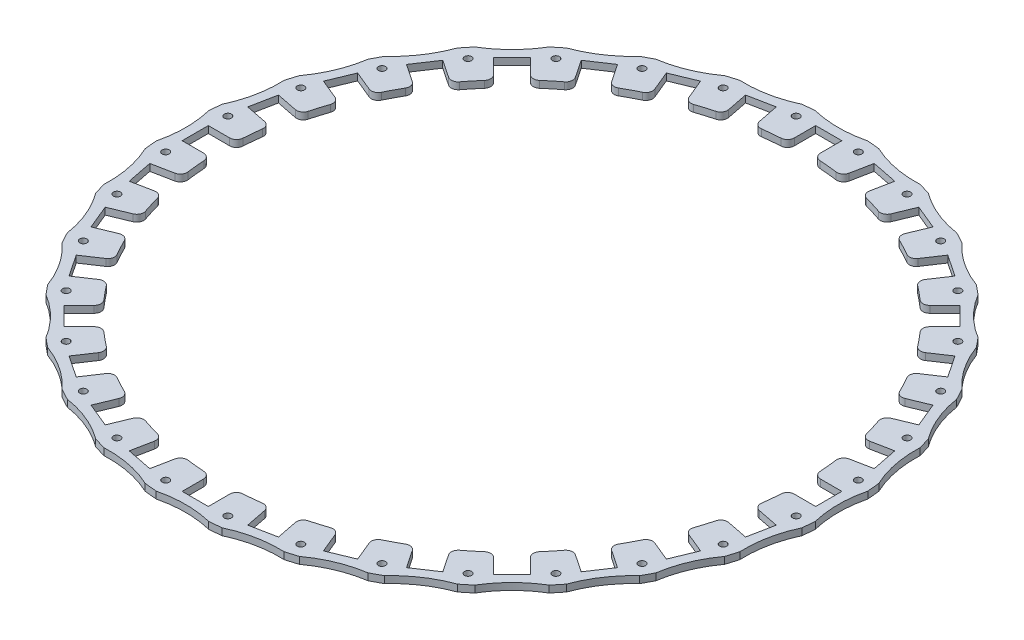
from build123d import *

# Parameters (mm, degrees)
BOSS_EXTRUDE1_DEPTH = 3.175
SKETCH4_R           = 1.6383
CUT_EXTRUDE1_DEPTH  = 215.868868303
CIRPATTERN1_COUNT   = 32


with BuildPart() as part:
    # Sketch1 → Boss-Extrude1 (new body)
    with BuildSketch(Plane(origin=(0, 0, 0), x_dir=(1, 0, 0), z_dir=(0, 1, 0))):
        with BuildLine():
            ThreePointArc((151.918645894, -12.1031), (150.455801978, 0), (151.918645894, 12.1031))
            ThreePointArc((151.918645894, 12.1031), (151.666152345, 14.937812186), (151.360769388, 17.767315221))
            ThreePointArc((151.360769388, 17.767315221), (147.564835931, 29.352470857), (146.638374036, 41.508399875))
            ThreePointArc((146.638374036, 41.508399875), (145.837707166, 44.239384814), (144.986183399, 46.954942481))
            ThreePointArc((144.986183399, 46.954942481), (139.003035995, 57.57694272), (135.722871698, 69.318555221))
            ThreePointArc((135.722871698, 69.318555221), (134.404800687, 71.840862692), (133.039859691, 74.338117635))
            ThreePointArc((133.039859691, 74.338117635), (125.099427339, 83.588764964), (119.591615516, 94.464837364))
            ThreePointArc((119.591615516, 94.464837364), (117.806793092, 96.681536507), (115.980888784, 98.864520617))
            ThreePointArc((115.980888784, 98.864520617), (106.388317847, 106.388317847), (98.864520617, 115.980888784))
            ThreePointArc((98.864520617, 115.980888784), (96.681536507, 117.806793092), (94.464837364, 119.591615516))
            ThreePointArc((94.464837364, 119.591615516), (83.588764964, 125.099427339), (74.338117635, 133.039859691))
            ThreePointArc((74.338117635, 133.039859691), (71.840862692, 134.404800687), (69.318555221, 135.722871698))
            ThreePointArc((69.318555221, 135.722871698), (57.57694272, 139.003035995), (46.954942481, 144.986183399))
            ThreePointArc((46.954942481, 144.986183399), (44.239384814, 145.837707166), (41.508399875, 146.638374036))
            ThreePointArc((41.508399875, 146.638374036), (29.352470857, 147.564835931), (17.767315221, 151.360769388))
            ThreePointArc((17.767315221, 151.360769388), (14.937812186, 151.666152345), (12.1031, 151.918645894))
            ThreePointArc((12.1031, 151.918645894), (0, 150.455801978), (-12.1031, 151.918645894))
            ThreePointArc((-12.1031, 151.918645894), (-14.937812186, 151.666152345), (-17.767315221, 151.360769388))
            ThreePointArc((-17.767315221, 151.360769388), (-29.352470857, 147.564835931), (-41.508399875, 146.638374036))
            ThreePointArc((-41.508399875, 146.638374036), (-44.239384814, 145.837707166), (-46.954942481, 144.986183399))
            ThreePointArc((-46.954942481, 144.986183399), (-57.57694272, 139.003035995), (-69.318555221, 135.722871698))
            ThreePointArc((-69.318555221, 135.722871698), (-71.840862692, 134.404800687), (-74.338117635, 133.039859691))
            ThreePointArc((-74.338117635, 133.039859691), (-83.588764964, 125.099427339), (-94.464837364, 119.591615516))
            ThreePointArc((-94.464837364, 119.591615516), (-96.681536507, 117.806793092), (-98.864520617, 115.980888784))
            ThreePointArc((-98.864520617, 115.980888784), (-106.388317847, 106.388317847), (-115.980888784, 98.864520617))
            ThreePointArc((-115.980888784, 98.864520617), (-117.806793092, 96.681536507), (-119.591615516, 94.464837364))
            ThreePointArc((-119.591615516, 94.464837364), (-125.099427339, 83.588764964), (-133.039859691, 74.338117635))
            ThreePointArc((-133.039859691, 74.338117635), (-134.404800687, 71.840862692), (-135.722871698, 69.318555221))
            ThreePointArc((-135.722871698, 69.318555221), (-139.003035995, 57.57694272), (-144.986183399, 46.954942481))
            ThreePointArc((-144.986183399, 46.954942481), (-145.837707166, 44.239384814), (-146.638374036, 41.508399875))
            ThreePointArc((-146.638374036, 41.508399875), (-147.564835931, 29.352470857), (-151.360769388, 17.767315221))
            ThreePointArc((-151.360769388, 17.767315221), (-151.666152345, 14.937812186), (-151.918645894, 12.1031))
            ThreePointArc((-151.918645894, 12.1031), (-150.455801978, 0), (-151.918645894, -12.1031))
            ThreePointArc((-151.918645894, -12.1031), (-151.666152345, -14.937812186), (-151.360769388, -17.767315221))
            ThreePointArc((-151.360769388, -17.767315221), (-147.564835931, -29.352470857), (-146.638374036, -41.508399875))
            ThreePointArc((-146.638374036, -41.508399875), (-145.837707166, -44.239384814), (-144.986183399, -46.954942481))
            ThreePointArc((-144.986183399, -46.954942481), (-139.003035995, -57.57694272), (-135.722871698, -69.318555221))
            ThreePointArc((-135.722871698, -69.318555221), (-134.404800687, -71.840862692), (-133.039859691, -74.338117635))
            ThreePointArc((-133.039859691, -74.338117635), (-125.099427339, -83.588764964), (-119.591615516, -94.464837364))
            ThreePointArc((-119.591615516, -94.464837364), (-117.806793092, -96.681536507), (-115.980888784, -98.864520617))
            ThreePointArc((-115.980888784, -98.864520617), (-106.388317847, -106.388317847), (-98.864520617, -115.980888784))
            ThreePointArc((-98.864520617, -115.980888784), (-96.681536507, -117.806793092), (-94.464837364, -119.591615516))
            ThreePointArc((-94.464837364, -119.591615516), (-83.588764964, -125.099427339), (-74.338117635, -133.039859691))
            ThreePointArc((-74.338117635, -133.039859691), (-71.840862692, -134.404800687), (-69.318555221, -135.722871698))
            ThreePointArc((-69.318555221, -135.722871698), (-57.57694272, -139.003035995), (-46.954942481, -144.986183399))
            ThreePointArc((-46.954942481, -144.986183399), (-44.239384814, -145.837707166), (-41.508399875, -146.638374036))
            ThreePointArc((-41.508399875, -146.638374036), (-29.352470857, -147.564835931), (-17.767315221, -151.360769388))
            ThreePointArc((-17.767315221, -151.360769388), (-14.937812186, -151.666152345), (-12.1031, -151.918645894))
            ThreePointArc((-12.1031, -151.918645894), (0, -150.455801978), (12.1031, -151.918645894))
            ThreePointArc((12.1031, -151.918645894), (14.937812186, -151.666152345), (17.767315221, -151.360769388))
            ThreePointArc((17.767315221, -151.360769388), (29.352470857, -147.564835931), (41.508399875, -146.638374036))
            ThreePointArc((41.508399875, -146.638374036), (44.239384814, -145.837707166), (46.954942481, -144.986183399))
            ThreePointArc((46.954942481, -144.986183399), (57.57694272, -139.003035995), (69.318555221, -135.722871698))
            ThreePointArc((69.318555221, -135.722871698), (71.840862692, -134.404800687), (74.338117635, -133.039859691))
            ThreePointArc((74.338117635, -133.039859691), (83.588764964, -125.099427339), (94.464837364, -119.591615516))
            ThreePointArc((94.464837364, -119.591615516), (96.681536507, -117.806793092), (98.864520617, -115.980888784))
            ThreePointArc((98.864520617, -115.980888784), (106.388317847, -106.388317847), (115.980888784, -98.864520617))
            ThreePointArc((115.980888784, -98.864520617), (117.806793092, -96.681536507), (119.591615516, -94.464837364))
            ThreePointArc((119.591615516, -94.464837364), (125.099427339, -83.588764964), (133.039859691, -74.338117635))
            ThreePointArc((133.039859691, -74.338117635), (134.404800687, -71.840862692), (135.722871698, -69.318555221))
            ThreePointArc((135.722871698, -69.318555221), (139.003035995, -57.57694272), (144.986183399, -46.954942481))
            ThreePointArc((144.986183399, -46.954942481), (145.837707166, -44.239384814), (146.638374036, -41.508399875))
            ThreePointArc((146.638374036, -41.508399875), (147.564835931, -29.352470857), (151.360769388, -17.767315221))
            ThreePointArc((151.360769388, -17.767315221), (151.666152345, -14.937812186), (151.918645894, -12.1031))
        make_face()
        with BuildLine():
            ThreePointArc((133.046389498, 8.993372093), (134.046123673, 6.887965445), (136.214160676, 6.0325))
            Line((136.214160676, 6.0325), (146.05, 6.0325))
            Line((146.05, 6.0325), (146.05, -6.0325))
            Line((146.05, -6.0325), (136.214160676, -6.0325))
            ThreePointArc((136.214160676, -6.0325), (134.046123673, -6.887965445), (133.046389498, -8.993372093))
            ThreePointArc((133.046389498, -8.993372093), (132.707883302, -13.070585663), (132.244460288, -17.135496))
            ThreePointArc((132.244460288, -17.135496), (132.81424039, -19.395486312), (134.773726141, -20.657477265))
            Line((134.773726141, -20.657477265), (144.42057257, -22.576354326))
            Line((144.42057257, -22.576354326), (142.066807835, -34.409528734))
            Line((142.066807835, -34.409528734), (132.419961406, -32.490651674))
            ThreePointArc((132.419961406, -32.490651674), (130.126689597, -32.906716553), (128.735420573, -34.77662994))
            ThreePointArc((128.735420573, -34.77662994), (127.60799377, -38.709461712), (126.360450633, -42.605856592))
            ThreePointArc((126.360450633, -42.605856592), (126.478380332, -44.933580407), (128.154012893, -46.553599264))
            Line((128.154012893, -46.553599264), (137.241143529, -50.317612017))
            Line((137.241143529, -50.317612017), (132.624067918, -61.464218577))
            Line((132.624067918, -61.464218577), (123.536937281, -57.700205824))
            ThreePointArc((123.536937281, -57.700205824), (121.206559816, -57.660880998), (119.47722163, -59.223441402))
            ThreePointArc((119.47722163, -59.223441402), (117.604200601, -62.860754856), (115.620479723, -66.438898008))
            ThreePointArc((115.620479723, -66.438898008), (115.282027048, -68.744902206), (116.609412798, -70.660692551))
            Line((116.609412798, -70.660692551), (124.787614307, -76.125192096))
            Line((124.787614307, -76.125192096), (118.084659446, -86.156872969))
            Line((118.084659446, -86.156872969), (109.906457937, -80.692373424))
            ThreePointArc((109.906457937, -80.692373424), (107.628529914, -80.199170122), (105.627580065, -81.394329223))
            ThreePointArc((105.627580065, -81.394329223), (103.080943956, -84.596344443), (100.437278619, -87.718729834))
            ThreePointArc((100.437278619, -87.718729834), (99.655450116, -89.914395966), (100.583578365, -92.05233505))
            Line((100.583578365, -92.05233505), (107.53856705, -99.007323735))
            Line((107.53856705, -99.007323735), (99.007323735, -107.53856705))
            Line((99.007323735, -107.53856705), (92.05233505, -100.583578365))
            ThreePointArc((92.05233505, -100.583578365), (89.914395966, -99.655450116), (87.718729834, -100.437278619))
            ThreePointArc((87.718729834, -100.437278619), (84.596344443, -103.080943956), (81.394329223, -105.627580065))
            ThreePointArc((81.394329223, -105.627580065), (80.199170122, -107.628529914), (80.692373424, -109.906457937))
            Line((80.692373424, -109.906457937), (86.156872969, -118.084659446))
            Line((86.156872969, -118.084659446), (76.125192096, -124.787614307))
            Line((76.125192096, -124.787614307), (70.660692551, -116.609412798))
            ThreePointArc((70.660692551, -116.609412798), (68.744902206, -115.282027048), (66.438898008, -115.620479723))
            ThreePointArc((66.438898008, -115.620479723), (62.860754856, -117.604200601), (59.223441402, -119.47722163))
            ThreePointArc((59.223441402, -119.47722163), (57.660880998, -121.206559816), (57.700205824, -123.536937281))
            Line((57.700205824, -123.536937281), (61.464218577, -132.624067918))
            Line((61.464218577, -132.624067918), (50.317612017, -137.241143529))
            Line((50.317612017, -137.241143529), (46.553599264, -128.154012893))
            ThreePointArc((46.553599264, -128.154012893), (44.933580407, -126.478380332), (42.605856592, -126.360450633))
            ThreePointArc((42.605856592, -126.360450633), (38.709461712, -127.60799377), (34.77662994, -128.735420573))
            ThreePointArc((34.77662994, -128.735420573), (32.906716553, -130.126689597), (32.490651674, -132.419961406))
            Line((32.490651674, -132.419961406), (34.409528734, -142.066807835))
            Line((34.409528734, -142.066807835), (22.576354326, -144.42057257))
            Line((22.576354326, -144.42057257), (20.657477265, -134.773726141))
            ThreePointArc((20.657477265, -134.773726141), (19.395486312, -132.81424039), (17.135496, -132.244460288))
            ThreePointArc((17.135496, -132.244460288), (13.070585663, -132.707883302), (8.993372093, -133.046389498))
            ThreePointArc((8.993372093, -133.046389498), (6.887965445, -134.046123673), (6.0325, -136.214160676))
            Line((6.0325, -136.214160676), (6.0325, -146.05))
            Line((6.0325, -146.05), (-6.0325, -146.05))
            Line((-6.0325, -146.05), (-6.0325, -136.214160676))
            ThreePointArc((-6.0325, -136.214160676), (-6.887965445, -134.046123673), (-8.993372093, -133.046389498))
            ThreePointArc((-8.993372093, -133.046389498), (-13.070585663, -132.707883302), (-17.135496, -132.244460288))
            ThreePointArc((-17.135496, -132.244460288), (-19.395486312, -132.81424039), (-20.657477265, -134.773726141))
            Line((-20.657477265, -134.773726141), (-22.576354326, -144.42057257))
            Line((-22.576354326, -144.42057257), (-34.409528734, -142.066807835))
            Line((-34.409528734, -142.066807835), (-32.490651674, -132.419961406))
            ThreePointArc((-32.490651674, -132.419961406), (-32.906716553, -130.126689597), (-34.77662994, -128.735420573))
            ThreePointArc((-34.77662994, -128.735420573), (-38.709461712, -127.60799377), (-42.605856592, -126.360450633))
            ThreePointArc((-42.605856592, -126.360450633), (-44.933580407, -126.478380332), (-46.553599264, -128.154012893))
            Line((-46.553599264, -128.154012893), (-50.317612017, -137.241143529))
            Line((-50.317612017, -137.241143529), (-61.464218577, -132.624067918))
            Line((-61.464218577, -132.624067918), (-57.700205824, -123.536937281))
            ThreePointArc((-57.700205824, -123.536937281), (-57.660880998, -121.206559816), (-59.223441402, -119.47722163))
            ThreePointArc((-59.223441402, -119.47722163), (-62.860754856, -117.604200601), (-66.438898008, -115.620479723))
            ThreePointArc((-66.438898008, -115.620479723), (-68.744902206, -115.282027048), (-70.660692551, -116.609412798))
            Line((-70.660692551, -116.609412798), (-76.125192096, -124.787614307))
            Line((-76.125192096, -124.787614307), (-86.156872969, -118.084659446))
            Line((-86.156872969, -118.084659446), (-80.692373424, -109.906457937))
            ThreePointArc((-80.692373424, -109.906457937), (-80.199170122, -107.628529914), (-81.394329223, -105.627580065))
            ThreePointArc((-81.394329223, -105.627580065), (-84.596344443, -103.080943956), (-87.718729834, -100.437278619))
            ThreePointArc((-87.718729834, -100.437278619), (-89.914395966, -99.655450116), (-92.05233505, -100.583578365))
            Line((-92.05233505, -100.583578365), (-99.007323735, -107.53856705))
            Line((-99.007323735, -107.53856705), (-107.53856705, -99.007323735))
            Line((-107.53856705, -99.007323735), (-100.583578365, -92.05233505))
            ThreePointArc((-100.583578365, -92.05233505), (-99.655450116, -89.914395966), (-100.437278619, -87.718729834))
            ThreePointArc((-100.437278619, -87.718729834), (-103.080943956, -84.596344443), (-105.627580065, -81.394329223))
            ThreePointArc((-105.627580065, -81.394329223), (-107.628529914, -80.199170122), (-109.906457937, -80.692373424))
            Line((-109.906457937, -80.692373424), (-118.084659446, -86.156872969))
            Line((-118.084659446, -86.156872969), (-124.787614307, -76.125192096))
            Line((-124.787614307, -76.125192096), (-116.609412798, -70.660692551))
            ThreePointArc((-116.609412798, -70.660692551), (-115.282027048, -68.744902206), (-115.620479723, -66.438898008))
            ThreePointArc((-115.620479723, -66.438898008), (-117.604200601, -62.860754856), (-119.47722163, -59.223441402))
            ThreePointArc((-119.47722163, -59.223441402), (-121.206559816, -57.660880998), (-123.536937281, -57.700205824))
            Line((-123.536937281, -57.700205824), (-132.624067918, -61.464218577))
            Line((-132.624067918, -61.464218577), (-137.241143529, -50.317612017))
            Line((-137.241143529, -50.317612017), (-128.154012893, -46.553599264))
            ThreePointArc((-128.154012893, -46.553599264), (-126.478380332, -44.933580407), (-126.360450633, -42.605856592))
            ThreePointArc((-126.360450633, -42.605856592), (-127.60799377, -38.709461712), (-128.735420573, -34.77662994))
            ThreePointArc((-128.735420573, -34.77662994), (-130.126689597, -32.906716553), (-132.419961406, -32.490651674))
            Line((-132.419961406, -32.490651674), (-142.066807835, -34.409528734))
            Line((-142.066807835, -34.409528734), (-144.42057257, -22.576354326))
            Line((-144.42057257, -22.576354326), (-134.773726141, -20.657477265))
            ThreePointArc((-134.773726141, -20.657477265), (-132.81424039, -19.395486312), (-132.244460288, -17.135496))
            ThreePointArc((-132.244460288, -17.135496), (-132.707883302, -13.070585663), (-133.046389498, -8.993372093))
            ThreePointArc((-133.046389498, -8.993372093), (-134.046123673, -6.887965445), (-136.214160676, -6.0325))
            Line((-136.214160676, -6.0325), (-146.05, -6.0325))
            Line((-146.05, -6.0325), (-146.05, 6.0325))
            Line((-146.05, 6.0325), (-136.214160676, 6.0325))
            ThreePointArc((-136.214160676, 6.0325), (-134.046123673, 6.887965445), (-133.046389498, 8.993372093))
            ThreePointArc((-133.046389498, 8.993372093), (-132.707883302, 13.070585663), (-132.244460288, 17.135496))
            ThreePointArc((-132.244460288, 17.135496), (-132.81424039, 19.395486312), (-134.773726141, 20.657477265))
            Line((-134.773726141, 20.657477265), (-144.42057257, 22.576354326))
            Line((-144.42057257, 22.576354326), (-142.066807835, 34.409528734))
            Line((-142.066807835, 34.409528734), (-132.419961406, 32.490651674))
            ThreePointArc((-132.419961406, 32.490651674), (-130.126689597, 32.906716553), (-128.735420573, 34.77662994))
            ThreePointArc((-128.735420573, 34.77662994), (-127.60799377, 38.709461712), (-126.360450633, 42.605856592))
            ThreePointArc((-126.360450633, 42.605856592), (-126.478380332, 44.933580407), (-128.154012893, 46.553599264))
            Line((-128.154012893, 46.553599264), (-137.241143529, 50.317612017))
            Line((-137.241143529, 50.317612017), (-132.624067918, 61.464218577))
            Line((-132.624067918, 61.464218577), (-123.536937281, 57.700205824))
            ThreePointArc((-123.536937281, 57.700205824), (-121.206559816, 57.660880998), (-119.47722163, 59.223441402))
            ThreePointArc((-119.47722163, 59.223441402), (-117.604200601, 62.860754856), (-115.620479723, 66.438898008))
            ThreePointArc((-115.620479723, 66.438898008), (-115.282027048, 68.744902206), (-116.609412798, 70.660692551))
            Line((-116.609412798, 70.660692551), (-124.787614307, 76.125192096))
            Line((-124.787614307, 76.125192096), (-118.084659446, 86.156872969))
            Line((-118.084659446, 86.156872969), (-109.906457937, 80.692373424))
            ThreePointArc((-109.906457937, 80.692373424), (-107.628529914, 80.199170122), (-105.627580065, 81.394329223))
            ThreePointArc((-105.627580065, 81.394329223), (-103.080943956, 84.596344443), (-100.437278619, 87.718729834))
            ThreePointArc((-100.437278619, 87.718729834), (-99.655450116, 89.914395966), (-100.583578365, 92.05233505))
            Line((-100.583578365, 92.05233505), (-107.53856705, 99.007323735))
            Line((-107.53856705, 99.007323735), (-99.007323735, 107.53856705))
            Line((-99.007323735, 107.53856705), (-92.05233505, 100.583578365))
            ThreePointArc((-92.05233505, 100.583578365), (-89.914395966, 99.655450116), (-87.718729834, 100.437278619))
            ThreePointArc((-87.718729834, 100.437278619), (-84.596344443, 103.080943956), (-81.394329223, 105.627580065))
            ThreePointArc((-81.394329223, 105.627580065), (-80.199170122, 107.628529914), (-80.692373424, 109.906457937))
            Line((-80.692373424, 109.906457937), (-86.156872969, 118.084659446))
            Line((-86.156872969, 118.084659446), (-76.125192096, 124.787614307))
            Line((-76.125192096, 124.787614307), (-70.660692551, 116.609412798))
            ThreePointArc((-70.660692551, 116.609412798), (-68.744902206, 115.282027048), (-66.438898008, 115.620479723))
            ThreePointArc((-66.438898008, 115.620479723), (-62.860754856, 117.604200601), (-59.223441402, 119.47722163))
            ThreePointArc((-59.223441402, 119.47722163), (-57.660880998, 121.206559816), (-57.700205824, 123.536937281))
            Line((-57.700205824, 123.536937281), (-61.464218577, 132.624067918))
            Line((-61.464218577, 132.624067918), (-50.317612017, 137.241143529))
            Line((-50.317612017, 137.241143529), (-46.553599264, 128.154012893))
            ThreePointArc((-46.553599264, 128.154012893), (-44.933580407, 126.478380332), (-42.605856592, 126.360450633))
            ThreePointArc((-42.605856592, 126.360450633), (-38.709461712, 127.60799377), (-34.77662994, 128.735420573))
            ThreePointArc((-34.77662994, 128.735420573), (-32.906716553, 130.126689597), (-32.490651674, 132.419961406))
            Line((-32.490651674, 132.419961406), (-34.409528734, 142.066807835))
            Line((-34.409528734, 142.066807835), (-22.576354326, 144.42057257))
            Line((-22.576354326, 144.42057257), (-20.657477265, 134.773726141))
            ThreePointArc((-20.657477265, 134.773726141), (-19.395486312, 132.81424039), (-17.135496, 132.244460288))
            ThreePointArc((-17.135496, 132.244460288), (-13.070585663, 132.707883302), (-8.993372093, 133.046389498))
            ThreePointArc((-8.993372093, 133.046389498), (-6.887965445, 134.046123673), (-6.0325, 136.214160676))
            Line((-6.0325, 136.214160676), (-6.0325, 146.05))
            Line((-6.0325, 146.05), (6.0325, 146.05))
            Line((6.0325, 146.05), (6.0325, 136.214160676))
            ThreePointArc((6.0325, 136.214160676), (6.887965445, 134.046123673), (8.993372093, 133.046389498))
            ThreePointArc((8.993372093, 133.046389498), (13.070585663, 132.707883302), (17.135496, 132.244460288))
            ThreePointArc((17.135496, 132.244460288), (19.395486312, 132.81424039), (20.657477265, 134.773726141))
            Line((20.657477265, 134.773726141), (22.576354326, 144.42057257))
            Line((22.576354326, 144.42057257), (34.409528734, 142.066807835))
            Line((34.409528734, 142.066807835), (32.490651674, 132.419961406))
            ThreePointArc((32.490651674, 132.419961406), (32.906716553, 130.126689597), (34.77662994, 128.735420573))
            ThreePointArc((34.77662994, 128.735420573), (38.709461712, 127.60799377), (42.605856592, 126.360450633))
            ThreePointArc((42.605856592, 126.360450633), (44.933580407, 126.478380332), (46.553599264, 128.154012893))
            Line((46.553599264, 128.154012893), (50.317612017, 137.241143529))
            Line((50.317612017, 137.241143529), (61.464218577, 132.624067918))
            Line((61.464218577, 132.624067918), (57.700205824, 123.536937281))
            ThreePointArc((57.700205824, 123.536937281), (57.660880998, 121.206559816), (59.223441402, 119.47722163))
            ThreePointArc((59.223441402, 119.47722163), (62.860754856, 117.604200601), (66.438898008, 115.620479723))
            ThreePointArc((66.438898008, 115.620479723), (68.744902206, 115.282027048), (70.660692551, 116.609412798))
            Line((70.660692551, 116.609412798), (76.125192096, 124.787614307))
            Line((76.125192096, 124.787614307), (86.156872969, 118.084659446))
            Line((86.156872969, 118.084659446), (80.692373424, 109.906457937))
            ThreePointArc((80.692373424, 109.906457937), (80.199170122, 107.628529914), (81.394329223, 105.627580065))
            ThreePointArc((81.394329223, 105.627580065), (84.596344443, 103.080943956), (87.718729834, 100.437278619))
            ThreePointArc((87.718729834, 100.437278619), (89.914395966, 99.655450116), (92.05233505, 100.583578365))
            Line((92.05233505, 100.583578365), (99.007323735, 107.53856705))
            Line((99.007323735, 107.53856705), (107.53856705, 99.007323735))
            Line((107.53856705, 99.007323735), (100.583578365, 92.05233505))
            ThreePointArc((100.583578365, 92.05233505), (99.655450116, 89.914395966), (100.437278619, 87.718729834))
            ThreePointArc((100.437278619, 87.718729834), (103.080943956, 84.596344443), (105.627580065, 81.394329223))
            ThreePointArc((105.627580065, 81.394329223), (107.628529914, 80.199170122), (109.906457937, 80.692373424))
            Line((109.906457937, 80.692373424), (118.084659446, 86.156872969))
            Line((118.084659446, 86.156872969), (124.787614307, 76.125192096))
            Line((124.787614307, 76.125192096), (116.609412798, 70.660692551))
            ThreePointArc((116.609412798, 70.660692551), (115.282027048, 68.744902206), (115.620479723, 66.438898008))
            ThreePointArc((115.620479723, 66.438898008), (117.604200601, 62.860754856), (119.47722163, 59.223441402))
            ThreePointArc((119.47722163, 59.223441402), (121.206559816, 57.660880998), (123.536937281, 57.700205824))
            Line((123.536937281, 57.700205824), (132.624067918, 61.464218577))
            Line((132.624067918, 61.464218577), (137.241143529, 50.317612017))
            Line((137.241143529, 50.317612017), (128.154012893, 46.553599264))
            ThreePointArc((128.154012893, 46.553599264), (126.478380332, 44.933580407), (126.360450633, 42.605856592))
            ThreePointArc((126.360450633, 42.605856592), (127.60799377, 38.709461712), (128.735420573, 34.77662994))
            ThreePointArc((128.735420573, 34.77662994), (130.126689597, 32.906716553), (132.419961406, 32.490651674))
            Line((132.419961406, 32.490651674), (142.066807835, 34.409528734))
            Line((142.066807835, 34.409528734), (144.42057257, 22.576354326))
            Line((144.42057257, 22.576354326), (134.773726141, 20.657477265))
            ThreePointArc((134.773726141, 20.657477265), (132.81424039, 19.395486312), (132.244460288, 17.135496))
            ThreePointArc((132.244460288, 17.135496), (132.707883302, 13.070585663), (133.046389498, 8.993372093))
        make_face(mode=Mode.SUBTRACT)
    extrude(amount=BOSS_EXTRUDE1_DEPTH)

    # Sketch4 → Cut-Extrude1 (cut, through all)
    with BuildSketch(Plane(origin=(0, 3.175, 0), x_dir=(1, 0, 0), z_dir=(0, 1, 0))):
        with Locations((145.34672933, 14.315403345)):
            Circle(SKETCH4_R)
    cut_extrude1 = extrude(amount=-CUT_EXTRUDE1_DEPTH, mode=Mode.SUBTRACT)

    # CirPattern1: Cut-Extrude1 ×32 about axis
    cirpattern1_axis = Axis((0, 50, 0), (0, -1, 0))
    for i in range(1, CIRPATTERN1_COUNT):
        add(cut_extrude1.rotate(cirpattern1_axis, i * 360 / CIRPATTERN1_COUNT), mode=Mode.SUBTRACT)


solid = part.part
